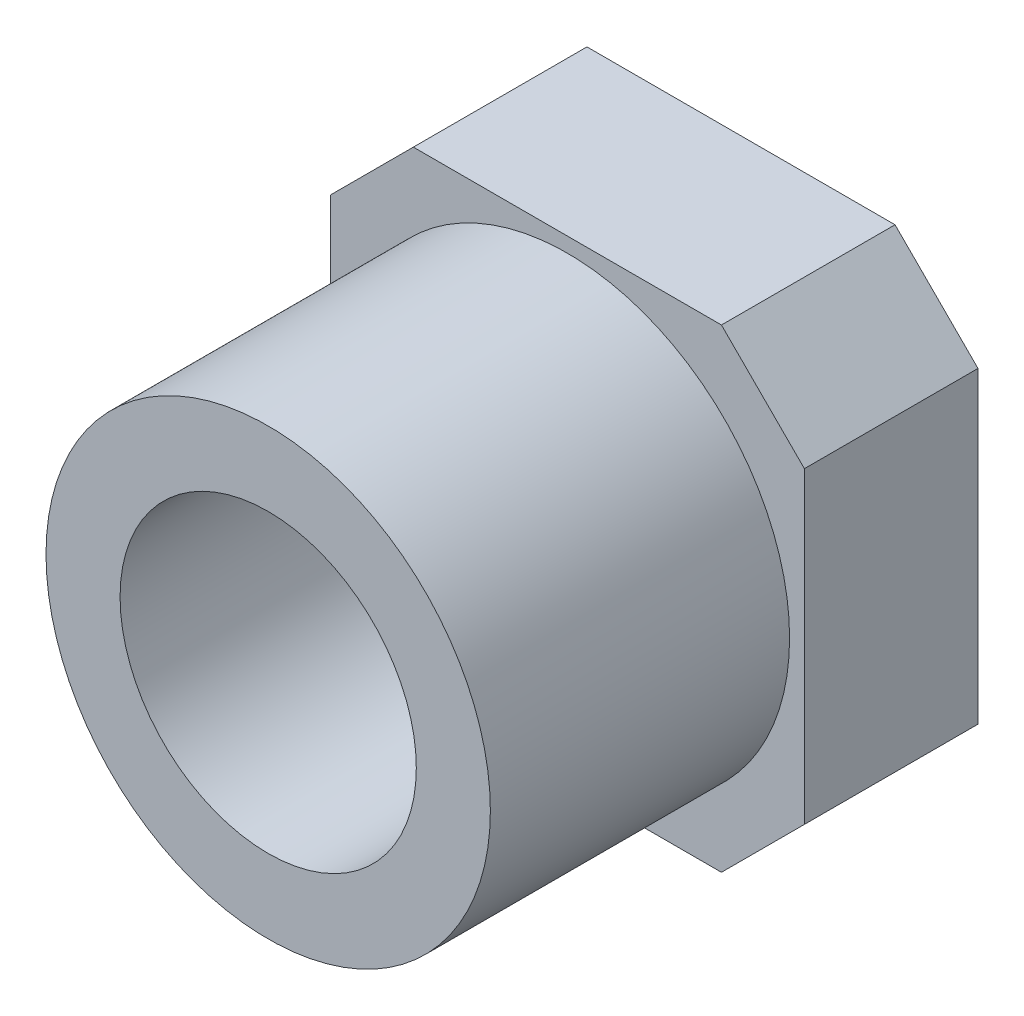
from build123d import *
from build123d.topology import SkipClean

# Parameters (mm, degrees)
SKETCH1_R           = 9.525
SKETCH1_R_2         = 6.35
BOSS_EXTRUDE1_DEPTH = 12.827
BOSS_EXTRUDE2_START = 7.4422
SKETCH2_W           = 20.32
SKETCH2_H           = 20.32
SKETCH2_R           = 6.35
BOSS_EXTRUDE2_DEPTH = 7.4422
CHAMFER1_SIZE       = 3.556


with BuildPart() as part:
    # Sketch1 → Boss-Extrude1 (new body)
    with BuildSketch(Plane.XY):
        Circle(SKETCH1_R)
        Circle(SKETCH1_R_2, mode=Mode.SUBTRACT)
    extrude(amount=BOSS_EXTRUDE1_DEPTH)

    # Sketch2 → Boss-Extrude2 (add)
    with SkipClean():  # the faces are left unmerged after this step: merging them gives an invalid solid
        with BuildSketch(Plane(origin=(0, 0, 0), x_dir=(-1, 0, 0), z_dir=(0, 0, -1)).offset(BOSS_EXTRUDE2_START)):
            Rectangle(SKETCH2_W, SKETCH2_H)
            Circle(SKETCH2_R, mode=Mode.SUBTRACT)
        extrude(amount=-BOSS_EXTRUDE2_DEPTH)

    # Chamfer1
    chamfer1_edges = [part.edges().sort_by_distance(p)[0] for p in [
        (-10.16, -10.16, -3.7211),
        (-10.16, 10.16, -3.7211),
        (10.16, 10.16, -3.7211),
        (10.16, -10.16, -3.7211),
    ]]
    chamfer(chamfer1_edges, length=CHAMFER1_SIZE)


solid = part.part
